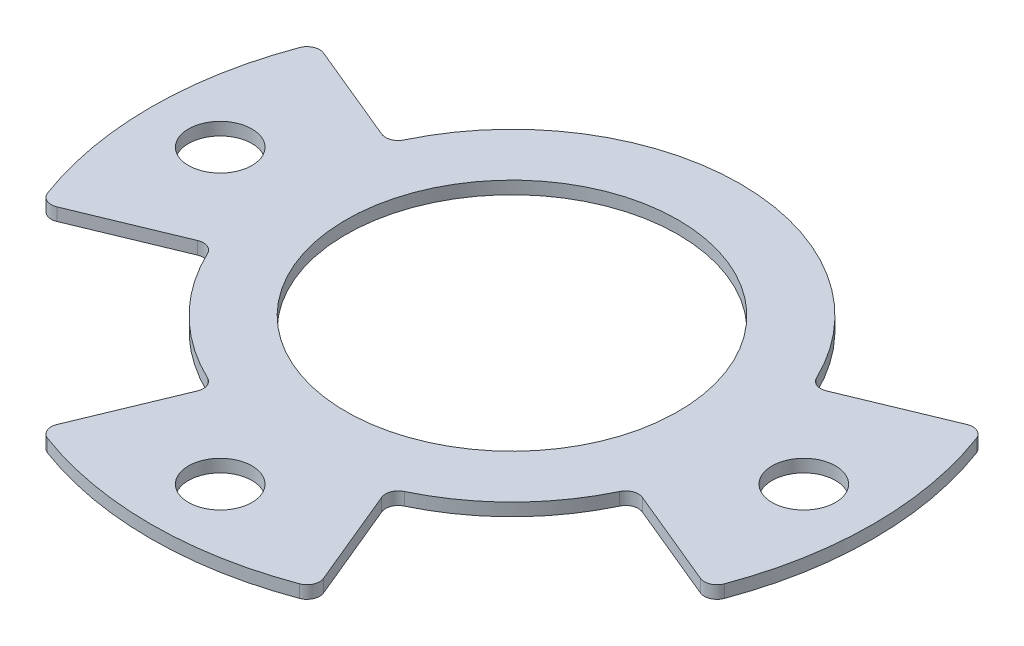
from build123d import *

# Parameters (mm, degrees)
SKETCH1_R      = 72.3
EXTRUDE1_DEPTH = 2.54
SKETCH2_R      = 6.35
EXTRUDE2_DEPTH = 103.279184588
SKETCH3_R      = 33.25
EXTRUDE3_DEPTH = 103.279184588
EXTRUDE4_DEPTH = 2.54
FILLET1_R      = 2.54


with BuildPart() as part:
    # Sketch1 → Extrude1 (new body)
    with BuildSketch(Plane(origin=(0, 0, 0), x_dir=(1, 0, 0), z_dir=(0, 1, 0))):
        with Locations(Location((0, 0, 0), (0, 0, 270))):
            Circle(SKETCH1_R)
    extrude(amount=EXTRUDE1_DEPTH)

    # Sketch2 → Extrude2 (cut, through all)
    with BuildSketch(Plane.XZ):
        with Locations(Location((-58.42, 0, 0), (0, 0, 270))):
            Circle(SKETCH2_R)
        with Locations(Location((58.42, 0, 0), (0, 0, 90))):
            Circle(SKETCH2_R)
        with Locations(Location((0, 58.42, 0), (0, 0, 270))):
            Circle(SKETCH2_R)
    extrude(amount=-EXTRUDE2_DEPTH, mode=Mode.SUBTRACT)

    # Sketch3 → Extrude3 (cut, through all)
    with BuildSketch(Plane.XZ):
        with Locations(Location((0, 0, 0), (0, 0, 270))):
            Circle(SKETCH3_R)
    extrude(amount=-EXTRUDE3_DEPTH, mode=Mode.SUBTRACT)

    # Sketch4 → Extrude4 (cut)
    with BuildSketch(Plane.XZ):
        with BuildLine():
            Line((-42.239772226, -17.496286528), (-196.027114776, -81.197089533))
            Line((-196.027114776, -81.197089533), (196.027114776, -81.197089533))
            Line((196.027114776, -81.197089533), (42.239772226, -17.496286528))
            ThreePointArc((42.239772226, -17.496286528), (0, -45.72), (-42.239772226, -17.496286528))
        make_face()
        with BuildLine():
            Line((-42.239772226, 17.496286528), (-90.262778901, 37.388067198))
            Line((-90.262778901, 37.388067198), (-35.092483391, 84.720749339))
            Line((-35.092483391, 84.720749339), (-17.496286528, 42.239772226))
            ThreePointArc((-17.496286528, 42.239772226), (-32.328922036, 32.328922036), (-42.239772226, 17.496286528))
        make_face()
        with BuildLine():
            Line((42.239772226, 17.496286528), (90.262778901, 37.388067198))
            Line((90.262778901, 37.388067198), (35.092483391, 84.720749339))
            Line((35.092483391, 84.720749339), (17.496286528, 42.239772226))
            ThreePointArc((17.496286528, 42.239772226), (32.328922036, 32.328922036), (42.239772226, 17.496286528))
        make_face()
    extrude(amount=-EXTRUDE4_DEPTH, mode=Mode.SUBTRACT)

    # Fillet1
    fillet1_edges = [part.edges().sort_by_distance(p)[0] for p in [
        (66.796490201, 1.27, -27.66801216),
        (42.239772226, 1.27, -17.496286528),
        (-66.796490201, 1.27, -27.66801216),
        (-42.239772226, 1.27, -17.496286528),
        (-66.796490201, 1.27, 27.66801216),
        (-42.239772226, 1.27, 17.496286528),
        (-27.66801216, 1.27, 66.796490201),
        (-17.496286528, 1.27, 42.239772226),
        (27.66801216, 1.27, 66.796490201),
        (17.496286528, 1.27, 42.239772226),
        (66.796490201, 1.27, 27.66801216),
        (42.239772226, 1.27, 17.496286528),
    ]]
    fillet(fillet1_edges, radius=FILLET1_R)


solid = part.part
